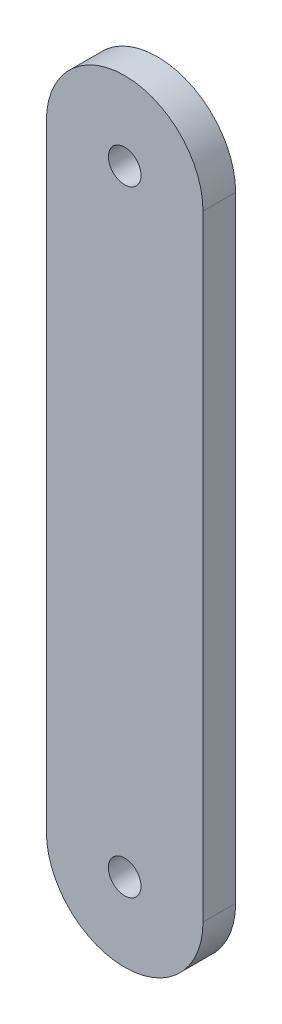
from build123d import *

# Parameters (mm, degrees)
SKETCH_1_R      = 2.5
EXTRUDE_1_DEPTH = 5


with BuildPart() as part:
    # 草图1 → 凸台-拉伸1 (new body)
    with BuildSketch(Plane.XY.offset(5)):
        with BuildLine():
            Line((12, -47.16), (12, 47.16))
            ThreePointArc((12, 47.16), (0, 59.16), (-12, 47.16))
            Line((-12, 47.16), (-12, -47.16))
            ThreePointArc((-12, -47.16), (0, -59.16), (12, -47.16))
        make_face()
        with Locations(Location((0, -47.16, 0), (0, 0, 180))):
            Circle(SKETCH_1_R, mode=Mode.SUBTRACT)
        with Locations(Location((0, 47.16, 0), (0, 0, 180))):
            Circle(SKETCH_1_R, mode=Mode.SUBTRACT)
    extrude(amount=-EXTRUDE_1_DEPTH)


solid = part.part
